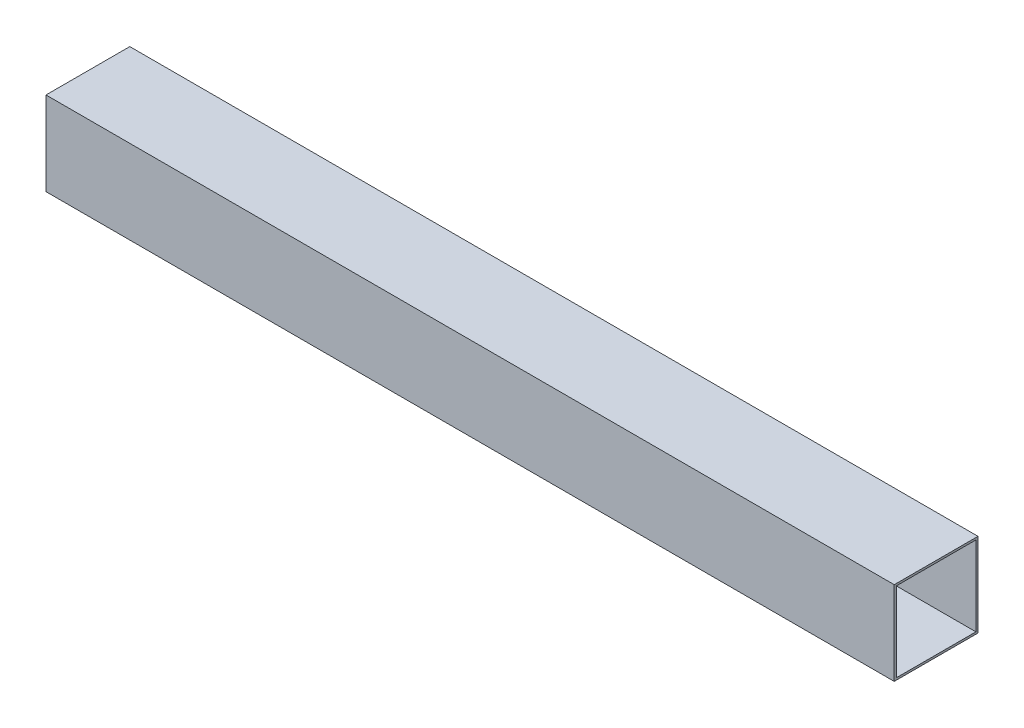
from build123d import *

# Parameters (mm, degrees)
SKETCH_1_W      = 80
SKETCH_1_H      = 80
SKETCH_1_W_2    = 76
SKETCH_1_H_2    = 76
EXTRUDE_1_DEPTH = 405


with BuildPart() as part:
    # 草图1 → 凸台-拉伸1 (new, symmetric)
    with BuildSketch(Plane(origin=(0, 0, 0), x_dir=(0, 0, -1), z_dir=(1, 0, 0))):
        Rectangle(SKETCH_1_W, SKETCH_1_H)
        Rectangle(SKETCH_1_W_2, SKETCH_1_H_2, mode=Mode.SUBTRACT)
    extrude(amount=EXTRUDE_1_DEPTH, both=True)


solid = part.part
